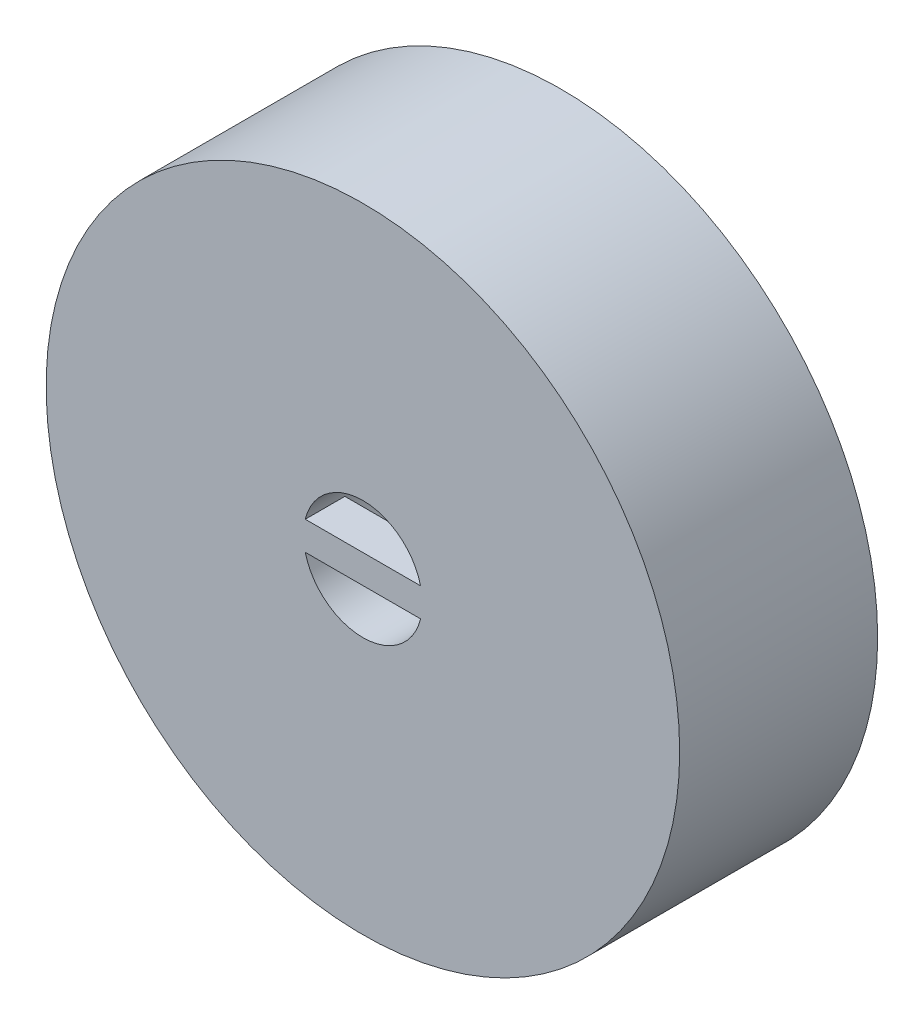
from build123d import *

# Parameters (mm, degrees)
SKETCH1_R           = 1
BOSS_EXTRUDE1_DEPTH = 1
SKETCH2_R           = 1
SKETCH2_R_2         = 0.375
CUT_EXTRUDE1_DEPTH  = 0.375
FILLET1_R           = 0.1
CUT_EXTRUDE2_DEPTH  = 0.125
CUT_EXTRUDE3_START  = 0.875
SKETCH4_R           = 0.1875
CUT_EXTRUDE3_DEPTH  = 0.875


with BuildPart() as part:
    # Sketch1 → Boss-Extrude1 (new body)
    with BuildSketch(Plane.XY):
        Circle(SKETCH1_R)
    extrude(amount=BOSS_EXTRUDE1_DEPTH)

    # Sketch2 → Cut-Extrude1 (cut)
    with BuildSketch(Plane.XY):
        Circle(SKETCH2_R)
        Circle(SKETCH2_R_2, mode=Mode.SUBTRACT)
    extrude(amount=CUT_EXTRUDE1_DEPTH, mode=Mode.SUBTRACT)

    # Fillet1
    fillet1_edges = [part.edges().sort_by_distance(p)[0] for p in [
        (-0.375, 0, 0.375),
    ]]
    fillet(fillet1_edges, radius=FILLET1_R)

    # Sketch3 → Cut-Extrude2 (cut)
    with BuildSketch(Plane.XY.offset(1)):
        with BuildLine():
            Line((-0.181979478, 0.045163255), (0, 0.045163255))
            Line((0, 0.045163255), (0.181979478, 0.045163255))
            ThreePointArc((0.181979478, 0.045163255), (0, 0.1875), (-0.181979478, 0.045163255))
        make_face()
        with BuildLine():
            Line((0.181979478, -0.045163255), (0, -0.045163255))
            Line((0, -0.045163255), (-0.181979478, -0.045163255))
            ThreePointArc((-0.181979478, -0.045163255), (0, -0.1875), (0.181979478, -0.045163255))
        make_face()
    extrude(amount=-CUT_EXTRUDE2_DEPTH, mode=Mode.SUBTRACT)

    # Sketch4 → Cut-Extrude3 (cut)
    with BuildSketch(Plane.XY.offset(CUT_EXTRUDE3_START)):
        Circle(SKETCH4_R)
    extrude(amount=-CUT_EXTRUDE3_DEPTH, mode=Mode.SUBTRACT)


solid = part.part
